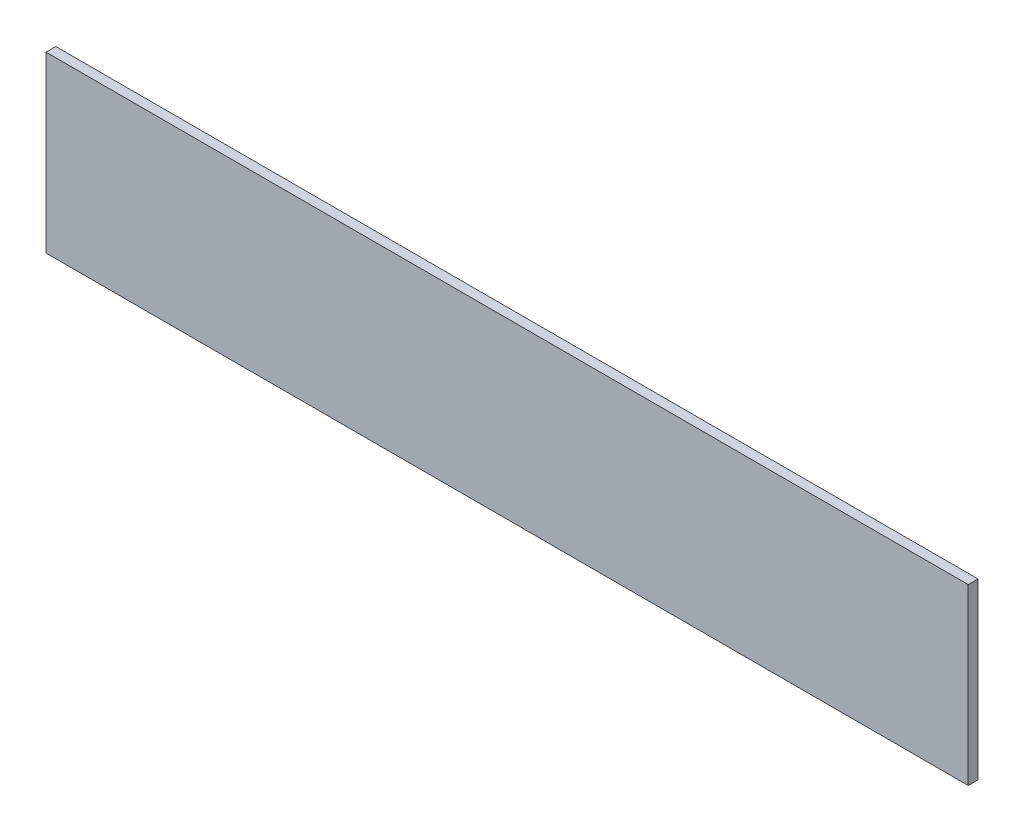
from build123d import *

# Parameters (mm, degrees)
SKETCH1_W           = 299.7
SKETCH1_H           = 56.55
BOSS_EXTRUDE1_DEPTH = 3.175


with BuildPart() as part:
    # Sketch1 → Boss-Extrude1 (new body)
    with BuildSketch(Plane.XY):
        Rectangle(SKETCH1_W, SKETCH1_H)
    extrude(amount=BOSS_EXTRUDE1_DEPTH)


solid = part.part
